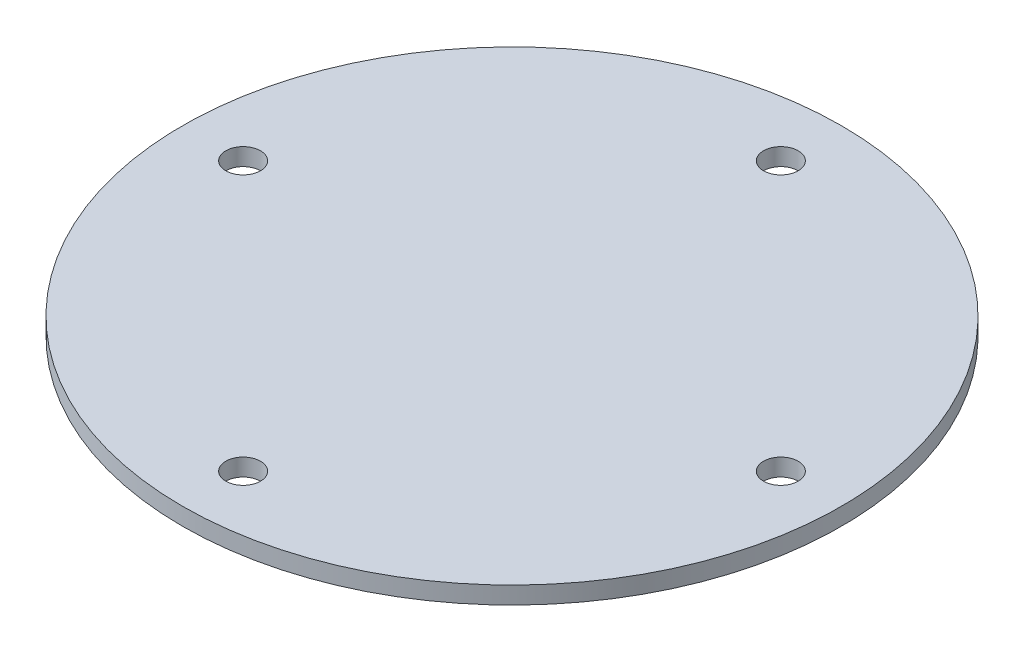
from build123d import *

# Parameters (mm, degrees)
SKETCH1_R           = 23.5
BOSS_EXTRUDE1_DEPTH = 8
SKETCH2_R           = 38
BOSS_EXTRUDE2_DEPTH = 2
CUT_EXTRUDE1_START  = -2
SKETCH3_R           = 15
CUT_EXTRUDE1_DEPTH  = 53.332310829
SKETCH4_R           = 2
CUT_EXTRUDE2_DEPTH  = 55.332310829


with BuildPart() as part:
    # Sketch1 → Boss-Extrude1 (new body)
    with BuildSketch(Plane(origin=(0, 0, 0), x_dir=(1, 0, 0), z_dir=(0, 1, 0))):
        with Locations(Location((0, 0, 0), (0, 0, 270))):
            Circle(SKETCH1_R)
    extrude(amount=-BOSS_EXTRUDE1_DEPTH)

    # Sketch2 → Boss-Extrude2 (add)
    with BuildSketch(Plane(origin=(0, 0, 0), x_dir=(1, 0, 0), z_dir=(0, 1, 0))):
        with Locations(Location((0, 0, 0), (0, 0, 270))):
            Circle(SKETCH2_R)
    extrude(amount=-BOSS_EXTRUDE2_DEPTH)

    # Sketch3 → Cut-Extrude1 (cut, through all)
    with BuildSketch(Plane(origin=(0, 0, 0), x_dir=(1, 0, 0), z_dir=(0, 1, 0)).offset(CUT_EXTRUDE1_START)):
        with Locations(Location((0, 0, 0), (0, 0, 270))):
            Circle(SKETCH3_R)
    extrude(amount=-CUT_EXTRUDE1_DEPTH, mode=Mode.SUBTRACT)

    # Sketch4 → Cut-Extrude2 (cut, through all)
    with BuildSketch(Plane(origin=(0, 0, 0), x_dir=(1, 0, 0), z_dir=(0, 1, 0))):
        with Locations(Location((0, 31, 0), (0, 0, 270))):
            Circle(SKETCH4_R)
        with Locations(Location((31, 0, 0), (0, 0, 270))):
            Circle(SKETCH4_R)
        with Locations(Location((0, -31, 0), (0, 0, 270))):
            Circle(SKETCH4_R)
        with Locations(Location((-31, 0, 0), (0, 0, 270))):
            Circle(SKETCH4_R)
    extrude(amount=-CUT_EXTRUDE2_DEPTH, mode=Mode.SUBTRACT)


solid = part.part
